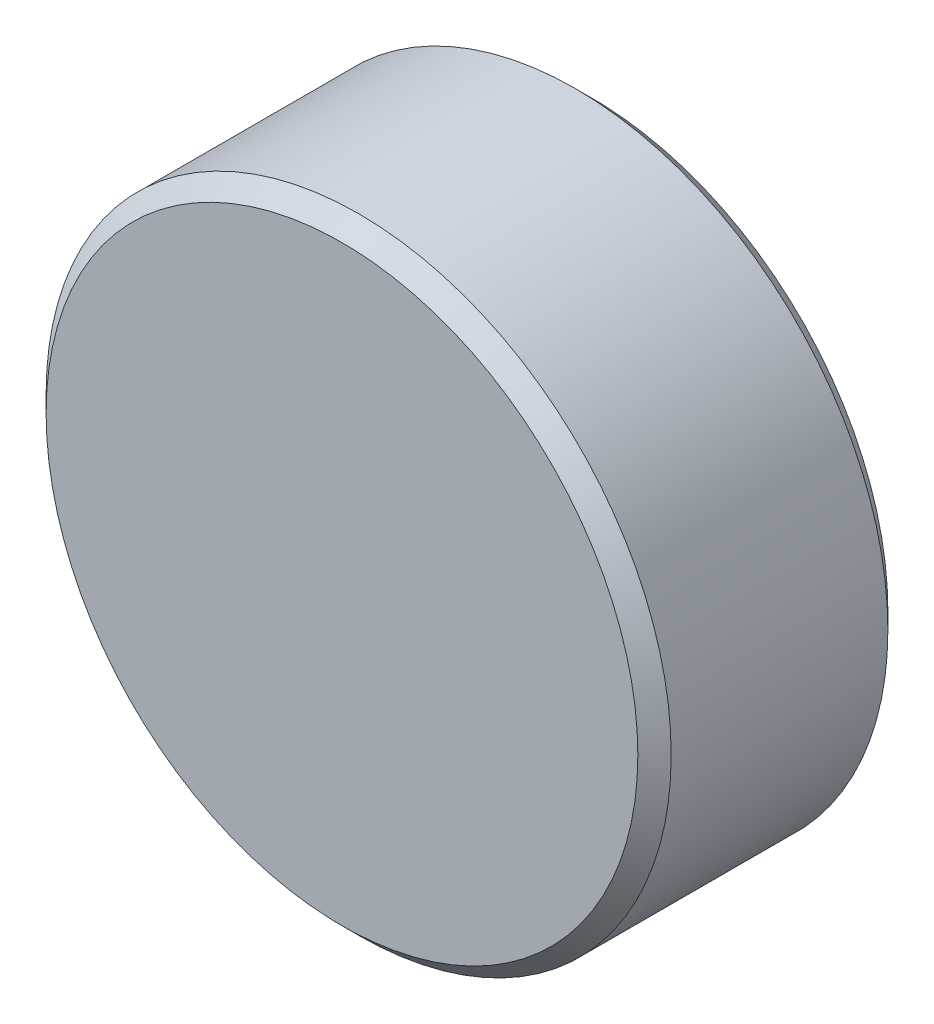
from build123d import *

# Parameters (mm, degrees)
SKETCH_1_R      = 37.5
EXTRUDE_1_DEPTH = 30
CHAMFER_1_SIZE  = 2


with BuildPart() as part:
    # ｽｹｯﾁ1 → ﾎﾞｽ - 押し出し1 (new body)
    with BuildSketch(Plane.XY):
        Circle(SKETCH_1_R)
    extrude(amount=EXTRUDE_1_DEPTH)

    # 面取り1
    chamfer_1_edges = [part.edges().sort_by_distance(p)[0] for p in [
        (-37.5, 0, 0),
        (-37.5, 0, 30),
    ]]
    chamfer(chamfer_1_edges, length=CHAMFER_1_SIZE)


solid = part.part
